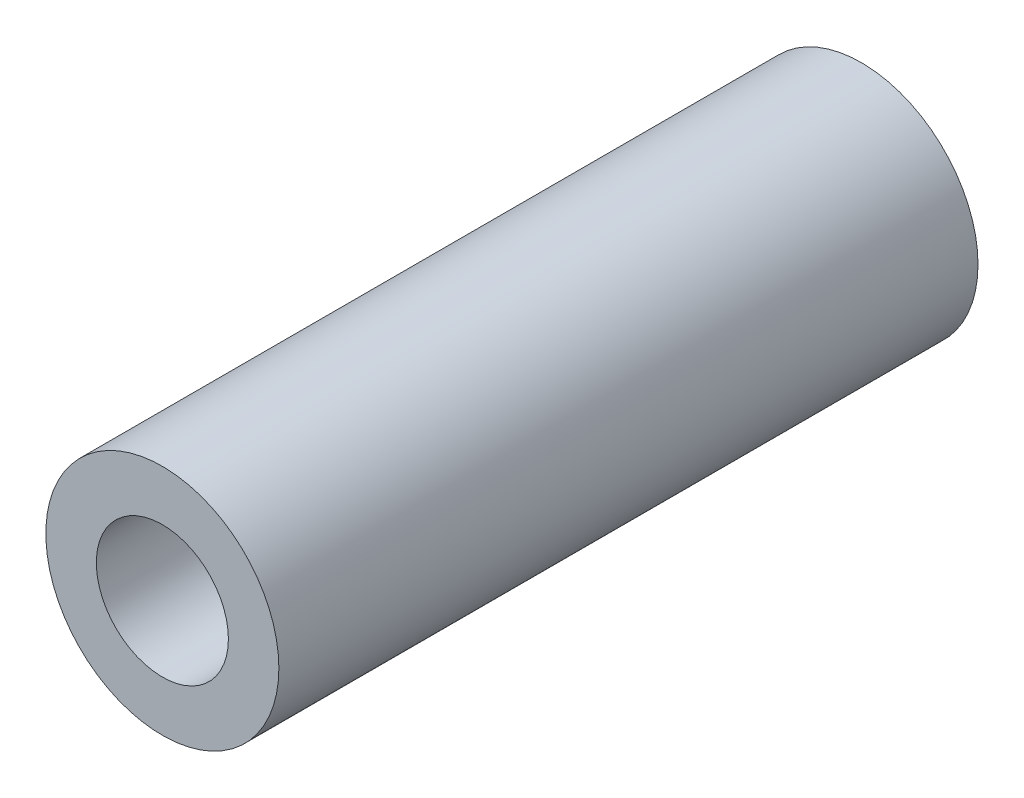
from build123d import *

# Parameters (mm, degrees)
MAIN_PROFILE_SKETCH_R   = 3
MAIN_PROFILE_SKETCH_R_2 = 1.7
MAIN_EXTRUSION_DEPTH    = 18


with BuildPart() as part:
    # Main Profile Sketch → Main Extrusion (new body)
    with BuildSketch(Plane.XY.offset(66.5)):
        with Locations((-155, -45)):
            Circle(MAIN_PROFILE_SKETCH_R)
        with Locations((-155, -45)):
            Circle(MAIN_PROFILE_SKETCH_R_2, mode=Mode.SUBTRACT)
    extrude(amount=-MAIN_EXTRUSION_DEPTH)


solid = part.part
